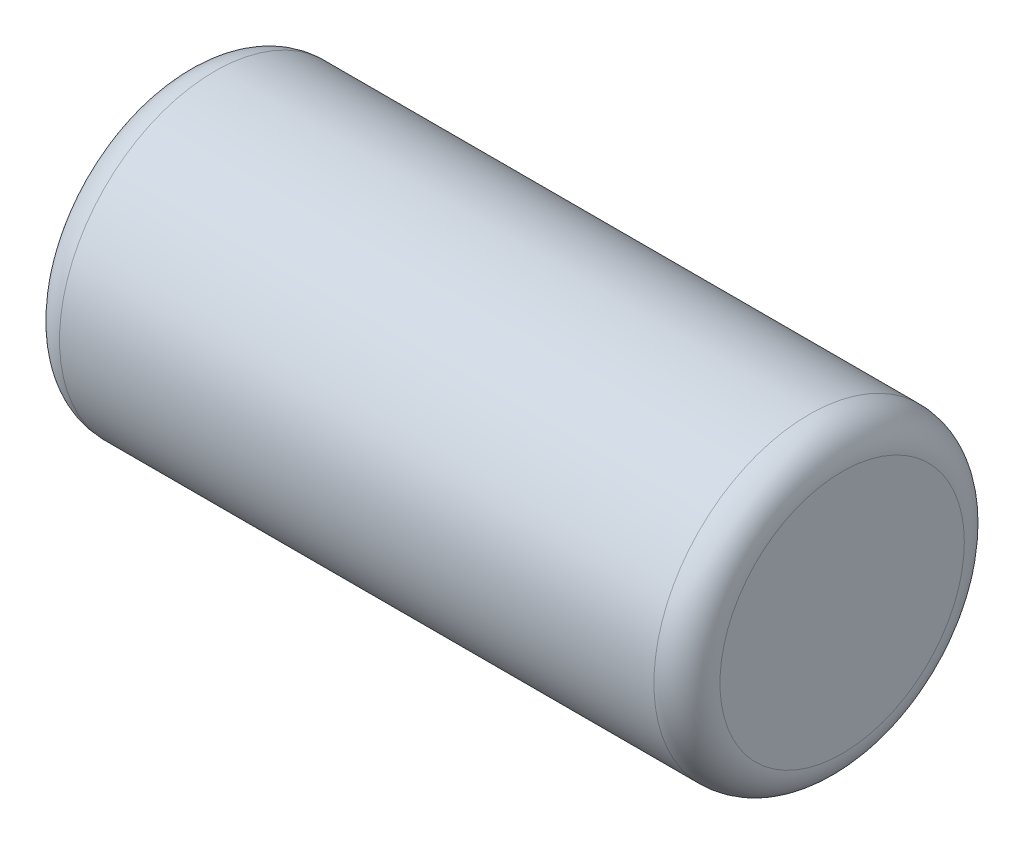
from build123d import *

# Parameters (mm, degrees)
CROQUIS1_R              = 2.35
SALIENTE_EXTRUIR1_DEPTH = 10
REDONDEO1_R             = 0.5


with BuildPart() as part:
    # Croquis1 → Saliente-Extruir1 (new body)
    with BuildSketch(Plane.YZ):
        with Locations(Location((0, 0, 0), (0, 0, 270))):
            Circle(CROQUIS1_R)
    extrude(amount=SALIENTE_EXTRUIR1_DEPTH)

    # Redondeo1
    redondeo1_edges = [part.edges().sort_by_distance(p)[0] for p in [
        (0, 0, 2.35),
        (10, 0, 2.35),
    ]]
    fillet(redondeo1_edges, radius=REDONDEO1_R)


solid = part.part
